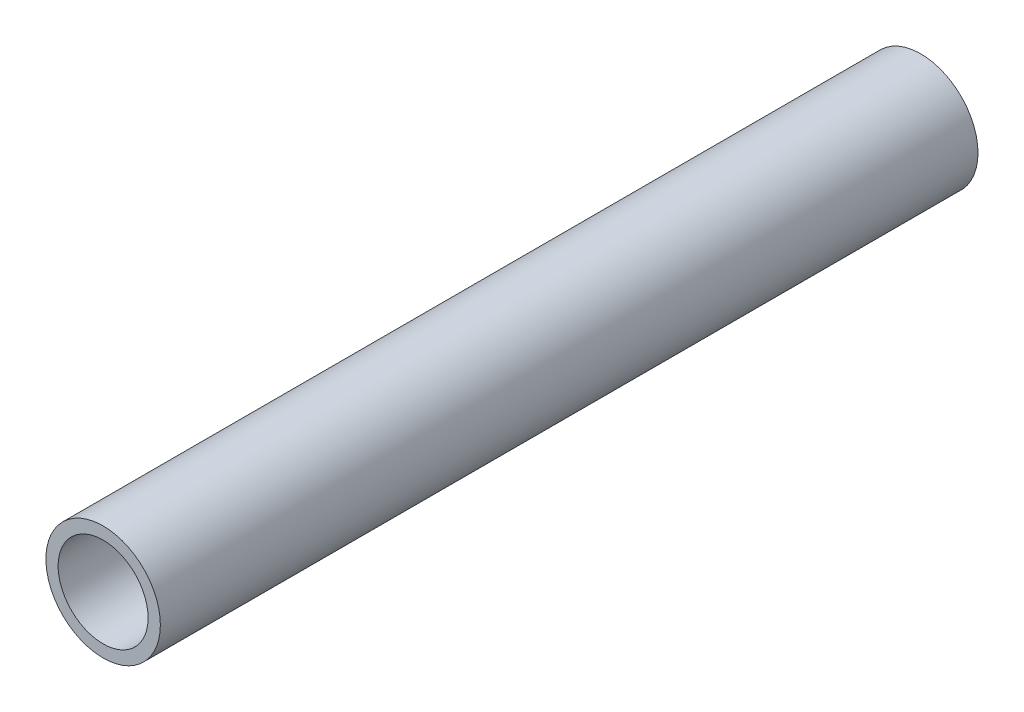
from build123d import *

# Parameters (mm, degrees)
SKETCH1_R           = 3.5
SKETCH1_R_2         = 2.75
BOSS_EXTRUDE1_DEPTH = 50


with BuildPart() as part:
    # Sketch1 → Boss-Extrude1 (new body)
    with BuildSketch(Plane.XY):
        Circle(SKETCH1_R)
        Circle(SKETCH1_R_2, mode=Mode.SUBTRACT)
    extrude(amount=BOSS_EXTRUDE1_DEPTH)


solid = part.part
